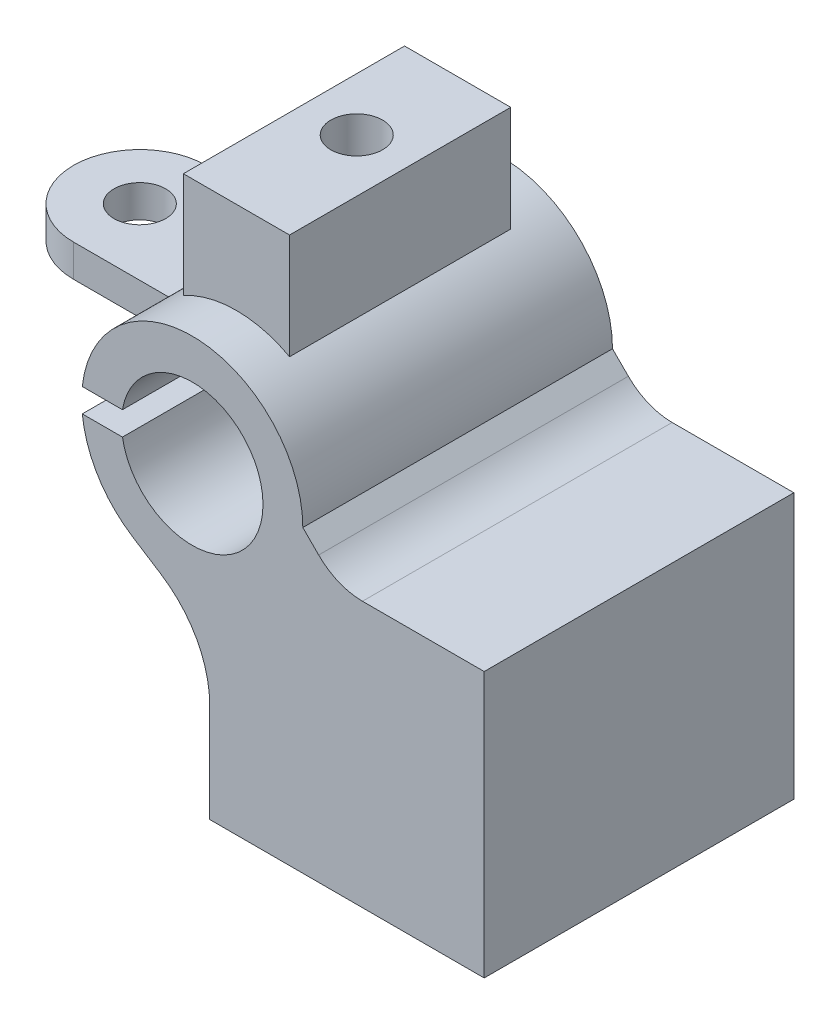
from build123d import *

# Parameters (mm, degrees)
BOSS_EXTRUDE1_DEPTH = 17.5
BOSS_EXTRUDE2_DEPTH = 7.5
BOSS_EXTRUDE3_DEPTH = 12.5
FILLET1_RADIUS      = 7.5
FILLET1_LENGTH      = 3.648240144


with BuildPart() as part:
    # Sketch1 → Boss-Extrude1 (new, symmetric)
    with BuildSketch(Plane.XY):
        with BuildLine():
            Line((14.293050208, -1.793050208), (12.5, 0))
            ThreePointArc((12.5, 0), (10.752906584, 6.373774392), (6, 10.9658561))
            ThreePointArc((6, 10.9658561), (0, 12.5), (-6, 10.9658561))
            ThreePointArc((-6, 10.9658561), (-9.228622735, 8.431045156), (-11.462073834, 4.987069623))
            ThreePointArc((-11.462073834, 4.987069623), (-12.083561193, 3.199616992), (-12.42809461, 1.338829478))
            Line((-12.42809461, 1.338829478), (-7.88717539, 1.338829478))
            ThreePointArc((-7.88717539, 1.338829478), (0.671787497, 7.971743947), (8, 0))
            ThreePointArc((8, 0), (0.671787497, -7.971743947), (-7.88717539, -1.338829478))
            Line((-7.88717539, -1.338829478), (-12.42809461, -1.338829478))
            ThreePointArc((-12.42809461, -1.338829478), (-10.628292495, -6.57946796), (-6.74, -10.527221856))
            Line((-6.74, -10.527221856), (-3.551888901, -12.568393696))
            ThreePointArc((-3.551888901, -12.568393696), (0.504932954, -16.914526677), (1.977711099, -22.674526677))
            Line((1.977711099, -22.674526677), (1.977711099, -33.84330274))
            Line((1.977711099, -33.84330274), (33, -33.84330274))
            Line((33, -33.84330274), (33, -3.84330274))
            Line((33, -3.84330274), (19.242797676, -3.84330274))
            ThreePointArc((19.242797676, -3.84330274), (16.56401365, -3.310459467), (14.293050208, -1.793050208))
        make_face()
    extrude(amount=BOSS_EXTRUDE1_DEPTH, both=True)

    # Sketch1<5> → Boss-Extrude3 (add, symmetric)
    with BuildSketch(Plane.XY):
        with BuildLine():
            ThreePointArc((-6, 10.9658561), (0, 12.5), (6, 10.9658561))
            Line((6, 10.9658561), (6, 22.88520947))
            Line((6, 22.88520947), (-6, 22.88520947))
            Line((-6, 22.88520947), (-6, 10.9658561))
        make_face()
    extrude(amount=BOSS_EXTRUDE3_DEPTH, both=True)

    # Sketch9 → #97 (0.23) Diameter Hole1 (revolve, cut)
    with BuildSketch(Plane(origin=(0, 22.88520947, -1.092219925), x_dir=(0, 0, 1), z_dir=(1, 0, 0))):
        Polygon((0, 0), (0, 11.755113868), (2.921, 10), (2.921, 0), align=None)
    revolve(axis=Axis((0, 29.23520947, -1.092219925), (0, -1, 0)), mode=Mode.SUBTRACT)


with BuildPart() as body_2:
    # Sketch1<4> → Boss-Extrude2 (new, symmetric)
    with BuildSketch(Plane.XY):
        with BuildLine():
            ThreePointArc((-12.42809461, 1.338829478), (-12.083561193, 3.199616992), (-11.462073834, 4.987069623))
            Line((-11.462073834, 4.987069623), (-30.92366752, 4.987069623))
            Line((-30.92366752, 4.987069623), (-30.92366752, 1.338829478))
            Line((-30.92366752, 1.338829478), (-12.42809461, 1.338829478))
        make_face()
    extrude(amount=BOSS_EXTRUDE2_DEPTH, both=True)

    # Fillet1: full round fillet: the end face becomes a half cylinder, R = half its width
    fillet1_face = Plane((-30.92366752, 3.16294955, 0), x_dir=(0, 1, 0), z_dir=(-1, 0, 0))  # on the end face: x along it, z out of the body
    fillet1_slab = fillet1_face.offset(-FILLET1_RADIUS / 2) * Box(FILLET1_LENGTH, 2 * FILLET1_RADIUS, FILLET1_RADIUS, mode=Mode.PRIVATE)  # the body's end, R deep
    fillet1_round = Plane((-23.42366752, 3.16294955, 0), x_dir=(-1, 0, 0), z_dir=(0, 1, 0)) * Cylinder(FILLET1_RADIUS, FILLET1_LENGTH, mode=Mode.PRIVATE)  # its axis R under the face
    add(fillet1_slab - fillet1_round, mode=Mode.SUBTRACT)

    # Sketch3 → #75 (0.23) Diameter Hole1 (revolve, cut)
    with BuildSketch(Plane(origin=(-23.42366752, 4.987069623, 0), x_dir=(0, 0, 1), z_dir=(1, 0, 0))):
        Polygon((0, 0), (0, 21.755113868), (2.921, 20), (2.921, 0), align=None)
    revolve(axis=Axis((-23.42366752, 11.337069623, 0), (0, -1, 0)), mode=Mode.SUBTRACT)


solid = Compound([part.part, body_2.part])
